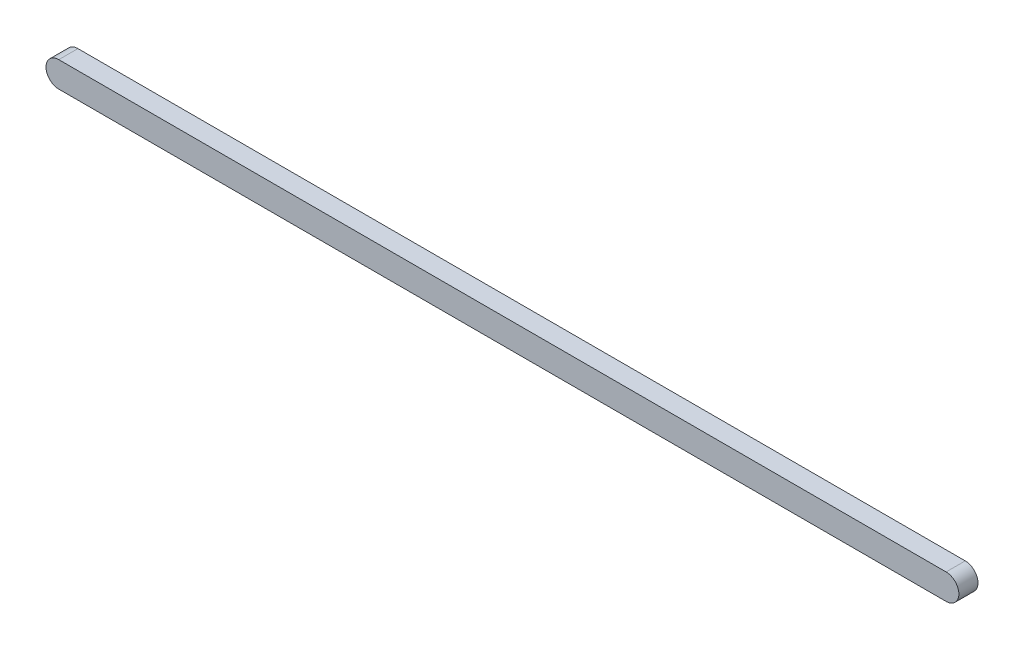
from build123d import *

# Parameters (mm, degrees)
EXTRUDE_1_DEPTH = 3


with BuildPart() as part:
    # 草图1 → 凸台-拉伸1 (new body)
    with BuildSketch(Plane.XY):
        with BuildLine():
            Line((0, 0), (139, 0))
            ThreePointArc((139, 0), (141, 2), (139, 4))
            Line((139, 4), (0, 4))
            ThreePointArc((0, 4), (-2, 2), (0, 0))
        make_face()
    extrude(amount=EXTRUDE_1_DEPTH)

    # 草图2 → 切除-旋转1 (revolve, cut)
    with BuildSketch(Plane(origin=(0, 2, 0), x_dir=(-1, 0, 0), z_dir=(0, -1, 0))):
        with BuildLine():
            Line((0, -0.5), (0, 0))
            Line((0, 0), (0, 0.5))
            ThreePointArc((0, 0.5), (-1, -0.5), (0, -1.5))
            Line((0, -1.5), (0, -0.5))
        make_face()
    revolve(axis=Axis((0, 2, 0), (0, 0, -1)), mode=Mode.SUBTRACT)

    # 草图4 → 切除-旋转3 (revolve, cut)
    with BuildSketch(Plane(origin=(0, 2, 0), x_dir=(-1, 0, 0), z_dir=(0, -1, 0))):
        with BuildLine():
            Line((-139, -0.5), (-139, 0))
            Line((-139, 0), (-139, 0.5))
            ThreePointArc((-139, 0.5), (-140, -0.5), (-139, -1.5))
            Line((-139, -1.5), (-139, -0.5))
        make_face()
    revolve(axis=Axis((139, 2, 1.5), (0, 0, -1)), mode=Mode.SUBTRACT)


solid = part.part
